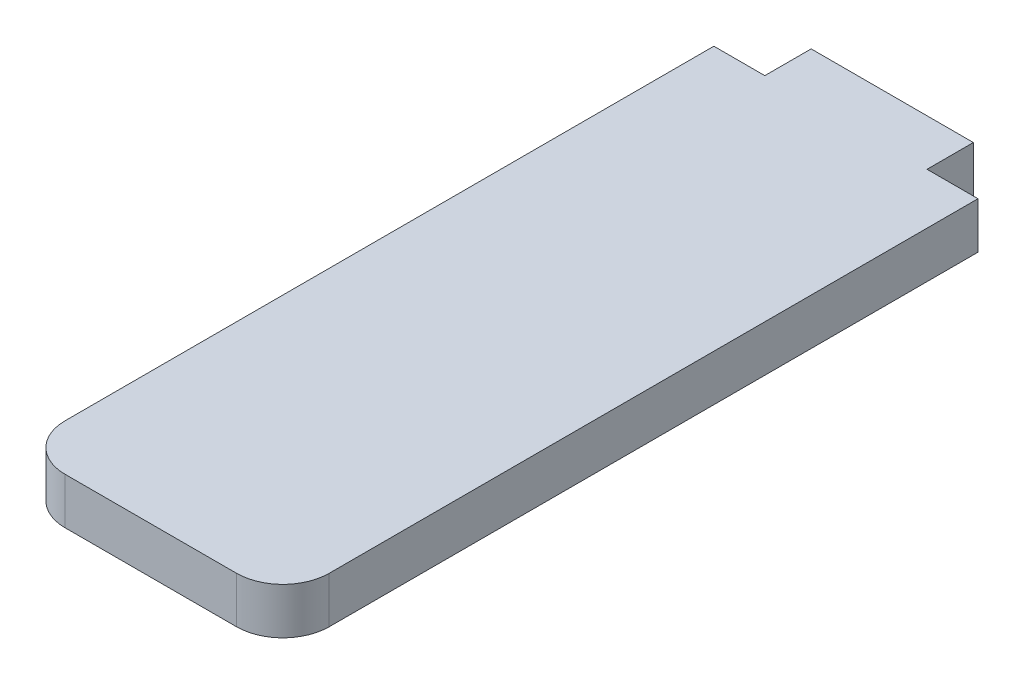
from build123d import *

# Parameters (mm, degrees)
BOSS_EXTRUDE1_DEPTH = 5


with BuildPart() as part:
    # Sketch1 → Boss-Extrude1 (new body)
    with BuildSketch(Plane(origin=(0, 0, 0), x_dir=(1, 0, 0), z_dir=(0, 1, 0))):
        with BuildLine():
            Line((8.75, -2.5), (14.25, -2.5))
            Line((14.25, -2.5), (14.25, -72.5))
            ThreePointArc((14.25, -72.5), (12.785533906, -76.035533906), (9.25, -77.5))
            Line((9.25, -77.5), (-9.25, -77.5))
            ThreePointArc((-9.25, -77.5), (-12.785533906, -76.035533906), (-14.25, -72.5))
            Line((-14.25, -72.5), (-14.25, -2.5))
            Line((-14.25, -2.5), (-8.75, -2.5))
            Line((-8.75, -2.5), (-8.75, 2.5))
            Line((-8.75, 2.5), (8.75, 2.5))
            Line((8.75, 2.5), (8.75, -2.5))
        make_face()
    extrude(amount=BOSS_EXTRUDE1_DEPTH)


solid = part.part
